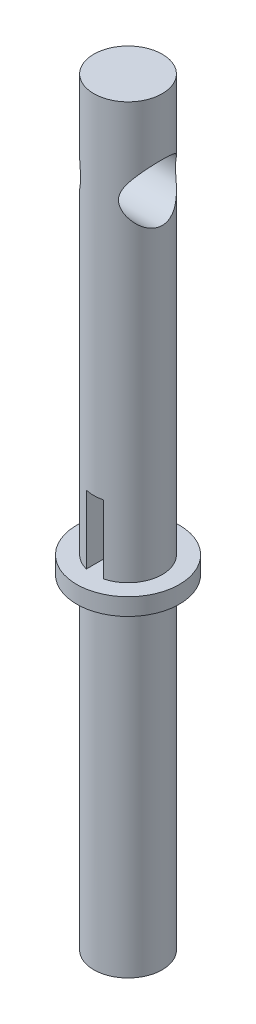
from build123d import *

# Parameters (mm, degrees)
SKETCH1_R           = 6
BOSS_EXTRUDE1_DEPTH = 100
SKETCH2_W           = 3
SKETCH2_H           = 12
CUT_EXTRUDE2_DEPTH  = 50
SKETCH3_R           = 2.5
CUT_EXTRUDE3_DEPTH  = 50
BOSS_EXTRUDE2_START = -60
SKETCH4_R           = 9
BOSS_EXTRUDE2_DEPTH = 3
SKETCH5_R           = 6
BOSS_EXTRUDE3_DEPTH = 10
SKETCH6_R           = 2.5
CUT_EXTRUDE4_DEPTH  = 10
SKETCH7_R           = 6
CUT_EXTRUDE5_DEPTH  = 12
SKETCH8_R           = 6
BOSS_EXTRUDE4_DEPTH = 30
SKETCH10_R          = 5
CUT_EXTRUDE6_DEPTH  = 30
BOSS_EXTRUDE5_START = -40
SKETCH11_R          = 6
BOSS_EXTRUDE5_DEPTH = 40
SKETCH12_R          = 6
BOSS_EXTRUDE6_DEPTH = 5
SKETCH13_R          = 5
CUT_EXTRUDE7_DEPTH  = 27.5


with BuildPart() as part:
    # Sketch1 → Boss-Extrude1 (new body)
    with BuildSketch(Plane(origin=(0, 0, 0), x_dir=(1, 0, 0), z_dir=(0, 1, 0))):
        with Locations(Location((0, 0, 0), (0, 0, 270))):
            Circle(SKETCH1_R)
    extrude(amount=BOSS_EXTRUDE1_DEPTH)

    # Sketch2 → Cut-Extrude2 (cut, symmetric)
    with BuildSketch(Plane.XY):
        with Locations((0, 66)):
            Rectangle(SKETCH2_W, SKETCH2_H)
    extrude(amount=CUT_EXTRUDE2_DEPTH, both=True, mode=Mode.SUBTRACT)

    # Sketch3 → Cut-Extrude3 (cut, symmetric)
    with BuildSketch(Plane.XY):
        with Locations(Location((0, 95, 0), (0, 0, 90))):
            Circle(SKETCH3_R)
    extrude(amount=CUT_EXTRUDE3_DEPTH, both=True, mode=Mode.SUBTRACT)

    # Sketch4 → Boss-Extrude2 (add)
    with BuildSketch(Plane.XZ.offset(BOSS_EXTRUDE2_START)):
        with Locations(Location((0, 0, 0), (0, 0, 270))):
            Circle(SKETCH4_R)
    extrude(amount=BOSS_EXTRUDE2_DEPTH)

    # Sketch5 → Boss-Extrude3 (add, symmetric)
    with BuildSketch(Plane(origin=(0, 100, 0), x_dir=(1, 0, 0), z_dir=(0, 1, 0))):
        with Locations(Location((0, 0, 0), (0, 0, 90))):
            Circle(SKETCH5_R)
    extrude(amount=BOSS_EXTRUDE3_DEPTH, both=True)

    # Sketch6 → Cut-Extrude4 (cut, symmetric)
    with BuildSketch(Plane.XY):
        with Locations((0, 105)):
            Circle(SKETCH6_R)
    extrude(amount=CUT_EXTRUDE4_DEPTH, both=True, mode=Mode.SUBTRACT)

    # Sketch7 → Cut-Extrude5 (cut)
    with BuildSketch(Plane(origin=(0, 110, 0), x_dir=(1, 0, 0), z_dir=(0, 1, 0))):
        with Locations(Location((0, 0, 0), (0, 0, 75.522487814))):
            Circle(SKETCH7_R)
    extrude(amount=-CUT_EXTRUDE5_DEPTH, mode=Mode.SUBTRACT)

    # Sketch8 → Boss-Extrude4 (add)
    with BuildSketch(Plane(origin=(0, 98, 0), x_dir=(1, 0, 0), z_dir=(0, 1, 0))):
        with Locations(Location((0, 0, 0), (0, 0, 75.522487814))):
            Circle(SKETCH8_R)
    extrude(amount=BOSS_EXTRUDE4_DEPTH)

    # Sketch10 → Cut-Extrude6 (cut, symmetric)
    with BuildSketch(Plane.XY):
        with Locations((0, 113)):
            Circle(SKETCH10_R)
    extrude(amount=CUT_EXTRUDE6_DEPTH, both=True, mode=Mode.SUBTRACT)

    # Sketch11 → Boss-Extrude5 (add)
    with BuildSketch(Plane(origin=(0, 128, 0), x_dir=(1, 0, 0), z_dir=(0, 1, 0)).offset(BOSS_EXTRUDE5_START)):
        with Locations(Location((0, 0, 0), (0, 0, 75.522487814))):
            Circle(SKETCH11_R)
    extrude(amount=BOSS_EXTRUDE5_DEPTH)

    # Sketch12 → Boss-Extrude6 (add)
    with BuildSketch(Plane(origin=(0, 128, 0), x_dir=(1, 0, 0), z_dir=(0, 1, 0))):
        with Locations(Location((0, 0, 0), (0, 0, 75.522487814))):
            Circle(SKETCH12_R)
    extrude(amount=BOSS_EXTRUDE6_DEPTH)

    # Sketch13 → Cut-Extrude7 (cut, symmetric)
    with BuildSketch(Plane(origin=(0, 0, 0), x_dir=(0, 0, -1), z_dir=(1, 0, 0))):
        with Locations((0, 118)):
            Circle(SKETCH13_R)
    extrude(amount=CUT_EXTRUDE7_DEPTH, both=True, mode=Mode.SUBTRACT)


solid = part.part
